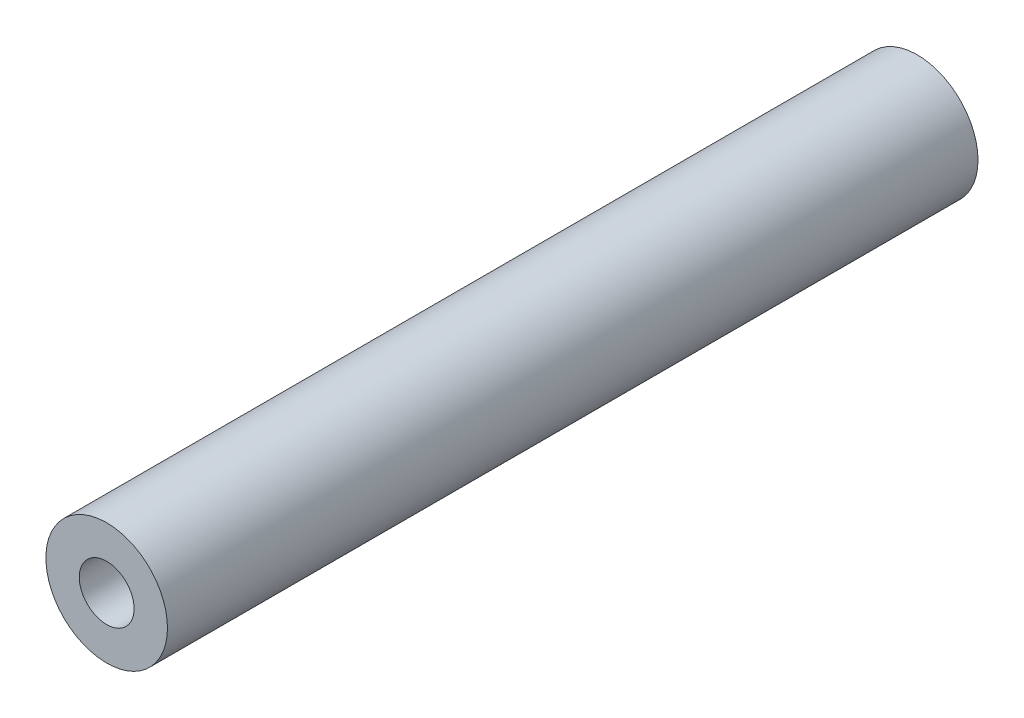
from build123d import *

# Parameters (mm, degrees)
SKETCH1_R                 = 3
BOSS_EXTRUDE1_DEPTH       = 40
F_6_32_TAPPED_HOLE1_D     = 2.7051
F_6_32_TAPPED_HOLE1_DEPTH = 12
F_6_32_TAPPED_HOLE1_TIP   = 0.81269403
F_6_32_TAPPED_HOLE2_D     = 2.7051
F_6_32_TAPPED_HOLE2_DEPTH = 12
F_6_32_TAPPED_HOLE2_TIP   = 0.81269403


with BuildPart() as part:
    # Sketch1 → Boss-Extrude1 (new body)
    with BuildSketch(Plane.XY):
        Circle(SKETCH1_R)
    extrude(amount=BOSS_EXTRUDE1_DEPTH)

    # #6-32 Tapped Hole1
    with Locations(Plane(origin=(0, 0, 0), x_dir=(-1, 0, 0), z_dir=(0, 0, -1))):
        with Locations((0, 0)):
            Hole(F_6_32_TAPPED_HOLE1_D / 2, depth=F_6_32_TAPPED_HOLE1_DEPTH)
            with Locations((0, 0, -(F_6_32_TAPPED_HOLE1_DEPTH + F_6_32_TAPPED_HOLE1_TIP / 2))):  # 118° drill point
                Cone(0, F_6_32_TAPPED_HOLE1_D / 2, F_6_32_TAPPED_HOLE1_TIP, mode=Mode.SUBTRACT)

    # #6-32 Tapped Hole2
    with Locations(Plane.XY.offset(40)):
        with Locations((0, 0)):
            Hole(F_6_32_TAPPED_HOLE2_D / 2, depth=F_6_32_TAPPED_HOLE2_DEPTH)
            with Locations((0, 0, -(F_6_32_TAPPED_HOLE2_DEPTH + F_6_32_TAPPED_HOLE2_TIP / 2))):  # 118° drill point
                Cone(0, F_6_32_TAPPED_HOLE2_D / 2, F_6_32_TAPPED_HOLE2_TIP, mode=Mode.SUBTRACT)


solid = part.part
